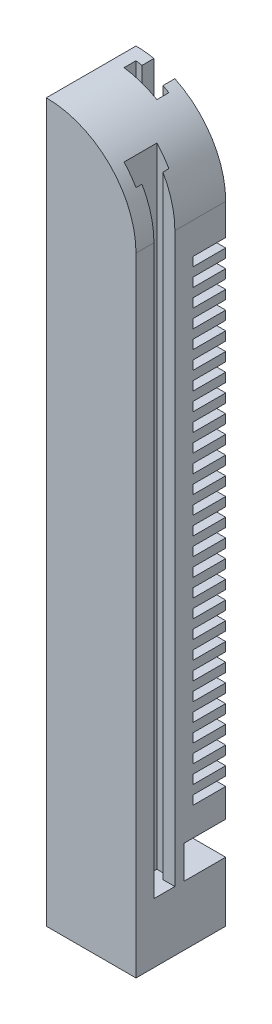
from build123d import *

# Parameters (mm, degrees)
SKETCH1_W           = 15
SKETCH1_H           = 15
BOSS_EXTRUDE1_DEPTH = 120
CUT_EXTRUDE1_DEPTH  = 110
CUT_EXTRUDE2_START  = -20.25
CUT_EXTRUDE2_DEPTH  = 1.5
LPATTERN1_COUNT     = 27
LPATTERN1_PITCH     = 3
CUT_EXTRUDE3_START  = -10
SKETCH6_W           = 7
SKETCH6_H           = 7
CUT_EXTRUDE3_DEPTH  = 5.5
CUT_EXTRUDE4_DEPTH  = 122.86057607


with BuildPart() as part:
    # Sketch1 → Boss-Extrude1 (new body)
    with BuildSketch(Plane(origin=(0, 0, 0), x_dir=(1, 0, 0), z_dir=(0, 1, 0))):
        with Locations((7.5, 7.5)):
            Rectangle(SKETCH1_W, SKETCH1_H)
    extrude(amount=BOSS_EXTRUDE1_DEPTH)

    # Sketch3 → Cut-Extrude1 (cut)
    with BuildSketch(Plane(origin=(0, 120, 0), x_dir=(1, 0, 0), z_dir=(0, 1, 0))):
        Polygon((15, 3), (13, 3), (13, 2), (11, 2), (11, 7.5), (13, 7.5), (13, 6.5), (15, 6.5), align=None)
        Polygon((3, 13), (2, 13), (2, 11), (7.5, 11), (7.5, 13), (6.5, 13), (6.5, 15), (3, 15), align=None)
    extrude(amount=-CUT_EXTRUDE1_DEPTH, mode=Mode.SUBTRACT)

    # Sketch5 → Cut-Extrude2 (cut)
    with BuildSketch(Plane(origin=(0, 120, 0), x_dir=(1, 0, 0), z_dir=(0, 1, 0)).offset(CUT_EXTRUDE2_START)):
        Polygon((15, 15), (15, 9.5), (9.5, 15), align=None)
    cut_extrude2 = extrude(amount=-CUT_EXTRUDE2_DEPTH, mode=Mode.SUBTRACT)

    # LPattern1: Cut-Extrude2 ×27
    with Locations(*[(0, -i * LPATTERN1_PITCH, 0) for i in range(1, LPATTERN1_COUNT)]):
        add(cut_extrude2, mode=Mode.SUBTRACT)

    # Sketch6 → Cut-Extrude3 (cut)
    with BuildSketch(Plane.XZ.offset(CUT_EXTRUDE3_START)):
        with Locations((11.5, -11.5)):
            Rectangle(SKETCH6_W, SKETCH6_H)
    extrude(amount=-CUT_EXTRUDE3_DEPTH, mode=Mode.SUBTRACT)

    # Sketch12 → Cut-Extrude4 (cut, through all)
    with BuildSketch(Plane.XY):
        with BuildLine():
            Line((0, 120), (15, 120))
            Line((15, 120), (15, 105))
            ThreePointArc((15, 105), (10.606601718, 115.606601718), (0, 120))
        make_face()
    extrude(amount=-CUT_EXTRUDE4_DEPTH, mode=Mode.SUBTRACT)


solid = part.part
